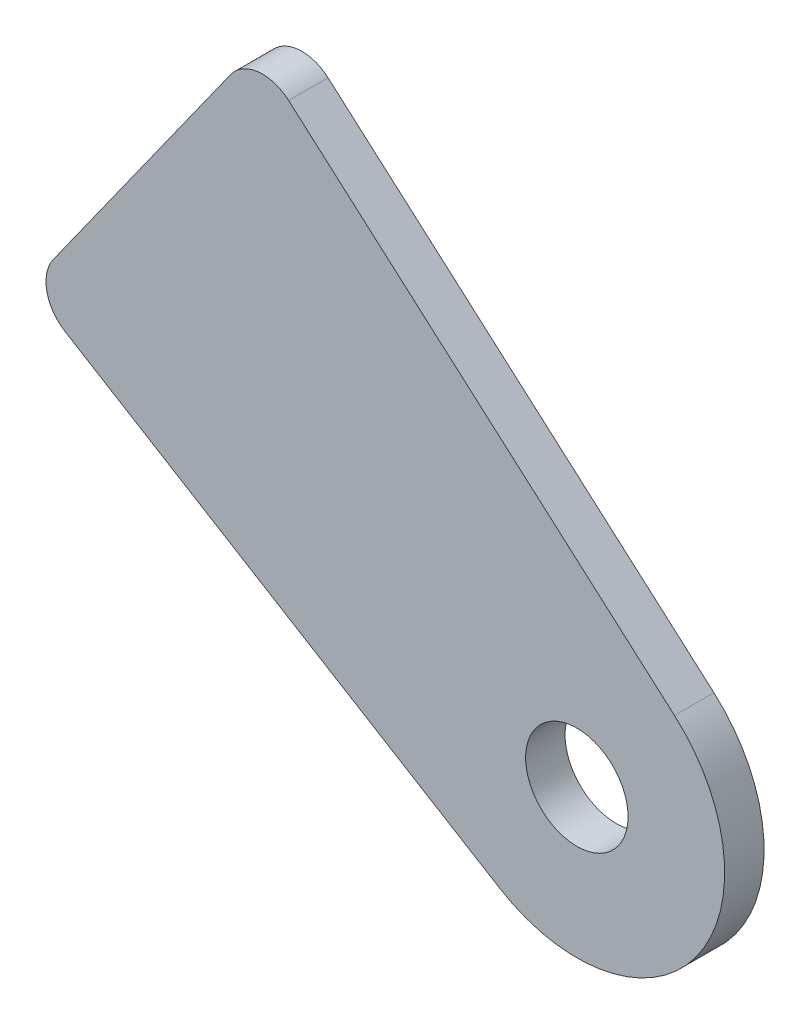
from build123d import *

# Parameters (mm, degrees)
SKETCH1_R           = 3.3
BOSS_EXTRUDE3_DEPTH = 2.54
FILLET1_R           = 2.54
FILLET2_R           = 2.54


with BuildPart() as part:
    # Sketch1 → Boss-Extrude3 (new body)
    with BuildSketch(Plane.XY):
        with BuildLine():
            Line((24.307803938, -29.663229905), (-6.055469212, -11.163390731))
            Line((-6.055469212, -11.163390731), (8.577809795, 9.365424663))
            Line((8.577809795, 9.365424663), (35.556707766, -14.378954182))
            ThreePointArc((35.556707766, -14.378954182), (36.935104815, -27.175040842), (24.307803938, -29.663229905))
        make_face()
        with Locations((29.263786665, -21.529112854)):
            Circle(SKETCH1_R, mode=Mode.SUBTRACT)
    extrude(amount=BOSS_EXTRUDE3_DEPTH)

    # Fillet1
    fillet1_edges = [part.edges().sort_by_distance(p)[0] for p in [
        (-6.055469212, -11.163390731, 1.27),
    ]]
    fillet(fillet1_edges, radius=FILLET1_R)

    # Fillet2
    fillet2_edges = [part.edges().sort_by_distance(p)[0] for p in [
        (8.577809795, 9.365424663, 1.27),
    ]]
    fillet(fillet2_edges, radius=FILLET2_R)


solid = part.part
